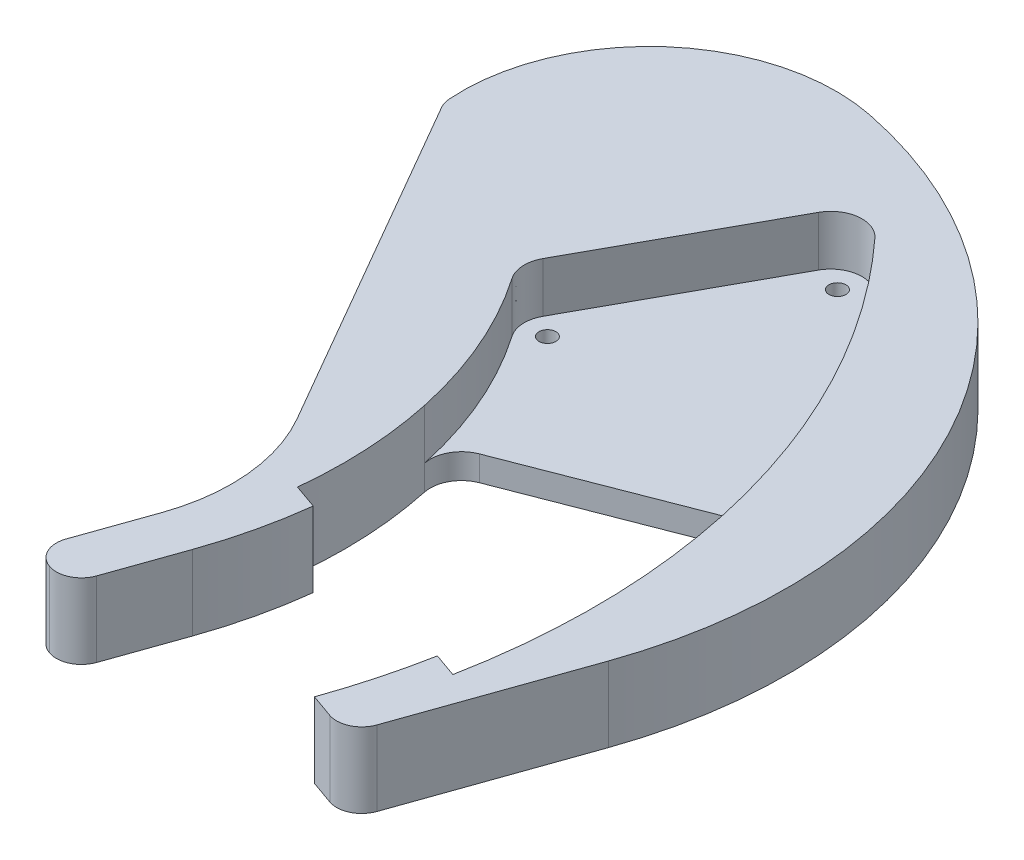
from build123d import *

# Parameters (mm, degrees)
BOSS_EXTRUDE1_DEPTH   = 19.05
CUT_EXTRUDE1_DEPTH    = 219.215212878
BOSS_EXTRUDE2_DEPTH   = 19.05
FILLET1_R             = 6.35
CUT_EXTRUDE2_DEPTH    = 12.7
F_8_CLEARANCE_HOLE1_D = 4.3053


with BuildPart() as part:
    # Sketch1 → Boss-Extrude1 (new body)
    with BuildSketch(Plane(origin=(0, 0, 0), x_dir=(1, 0, 0), z_dir=(0, 1, 0))):
        with BuildLine():
            Line((-47.453228006, 53.404284402), (-98.253228006, 141.392465427))
            ThreePointArc((-98.253228006, 141.392465427), (-82.921975522, 181.453316928), (-41.566473575, 192.839342769))
            ThreePointArc((-41.566473575, 192.839342769), (36.836225704, 136.004392842), (45.380299153, 39.546144899))
            Line((45.380299153, 39.546144899), (27.944541838, -9.861512816))
            Line((27.944541838, -9.861512816), (0, 0))
            Line((0, 0), (-43.950457827, 15.509934128))
            ThreePointArc((-43.950457827, 15.509934128), (-41.550098289, 34.840876427), (-47.453228006, 53.404284402))
        make_face()
    extrude(amount=BOSS_EXTRUDE1_DEPTH)

    # Sketch5 → Cut-Extrude1 (cut, through all)
    with BuildSketch(Plane(origin=(0, 19.05, 0), x_dir=(1, 0, 0), z_dir=(0, 1, 0))):
        with BuildLine():
            Line((-29.23664893, 81.427581144), (15.574383155, 98.792652007))
            ThreePointArc((15.574383155, 98.792652007), (22.053436092, 98.460407789), (26.120098061, 93.405630482))
            ThreePointArc((26.120098061, 93.405630482), (31.67419382, 55.261505814), (28.616328902, 16.836622098))
            Line((28.616328902, 16.836622098), (22.559524164, 18.974043348))
            ThreePointArc((22.559524164, 18.974043348), (19.726825076, 6.545871538), (15.949337201, -5.628454892))
            Line((15.949337201, -5.628454892), (-31.95525319, 11.276876204))
            ThreePointArc((-31.95525319, 11.276876204), (-28.372538305, 23.563648828), (-26.173781301, 36.171824553))
            Line((-26.173781301, 36.171824553), (-32.322028113, 38.341515332))
            ThreePointArc((-32.322028113, 38.341515332), (-31.887912186, 55.427050363), (-34.131380562, 72.370214577))
            ThreePointArc((-34.131380562, 72.370214577), (-33.353370645, 77.801041885), (-29.23664893, 81.427581144))
        make_face()
    extrude(amount=-CUT_EXTRUDE1_DEPTH, mode=Mode.SUBTRACT)

    # Sketch7 → Boss-Extrude2 (add)
    with BuildSketch(Plane(origin=(0, 0, 0), x_dir=(1, 0, 0), z_dir=(0, 1, 0))):
        Polygon((-43.950457827, 15.509934128), (-52.403123375, -8.442361068), (-40.408086707, -12.675359716), (-31.95525319, 11.276876204), align=None)
    extrude(amount=BOSS_EXTRUDE2_DEPTH)

    # Fillet1
    fillet1_edges = [part.edges().sort_by_distance(p)[0] for p in [
        (-98.253228006, 9.525, -141.392465427),
        (27.944541838, 9.525, 9.861512816),
        (-52.403123375, 9.525, 8.442361068),
        (-40.408086707, 9.525, 12.675359716),
    ]]
    fillet(fillet1_edges, radius=FILLET1_R)

    # Sketch6 → Cut-Extrude2 (cut)
    with BuildSketch(Plane(origin=(0, 19.05, 0), x_dir=(1, 0, 0), z_dir=(0, 1, 0))):
        with BuildLine():
            Line((-34.136031583, 72.371811773), (26.116293886, 93.401758977))
            add(Edge.make_bspline(
                [(26.116293886, 93.401758977), (24.324889601, 100.23803776), (22.130168151, 106.901258397), (16.96212823, 119.893613822), (13.988046064, 126.222420918), (9.776956475, 133.921680991), (8.910007749, 135.450921337), (7.126151123, 138.487965199), (6.207974968, 139.997768114), (3.386426272, 144.480432789), (1.42392697, 147.394611788), (-4.701484626, 155.920269738), (-9.100754748, 161.316287945), (-13.809441186, 166.430246232)],
                knots=[0, 0, 0, 0, 0.25, 0.25, 0.5, 0.5, 0.5625, 0.5625, 0.625, 0.625, 0.75, 0.75, 1, 1, 1, 1], degree=3))
            add(Edge.make_bspline(
                [(-26.604572492, 164.8773905), (-26.150591479, 165.703254328), (-25.515446259, 166.400295605), (-24.879031904, 167.098729697), (-24.095373437, 167.628794259), (-23.313760397, 168.1574753), (-22.428907317, 168.488425961), (-21.547481327, 168.818094831), (-20.612298709, 168.932538075), (-19.674896196, 169.047252981), (-18.735576663, 168.938540794), (-17.797334242, 168.829953267), (-16.909699728, 168.503685222), (-16.026331795, 168.178985445), (-15.242553256, 167.655985099), (-14.452846951, 167.129029268), (-13.809441186, 166.430246232)],
                knots=[0, 0, 0, 0.125, 0.125, 0.25, 0.25, 0.375, 0.375, 0.5, 0.5, 0.625, 0.625, 0.75, 0.75, 0.875, 0.875, 1, 1, 1], degree=2))
            Line((-26.604572492, 164.8773905), (-51.39264493, 119.783935416))
            add(Edge.make_bspline(
                [(-50.971516495, 111.453693883), (-51.597295758, 112.361285599), (-51.952278538, 113.405618938), (-52.307499269, 114.450652309), (-52.364051333, 115.554155451), (-52.420577964, 116.657162304), (-52.173441916, 117.734834771), (-51.926064332, 118.813560494), (-51.39264493, 119.783935416)],
                knots=[0, 0, 0, 0.25, 0.25, 0.5, 0.5, 0.75, 0.75, 1, 1, 1], degree=2))
            add(Edge.make_bspline(
                [(-50.971516495, 111.453693883), (-48.958817602, 108.534599247), (-47.092599274, 105.523689489), (-43.653878745, 99.317766492), (-42.08164257, 96.122586505), (-39.950407344, 91.187456603), (-39.27814351, 89.518531936), (-38.021441634, 86.160956199), (-37.435479748, 84.468826365), (-36.34793939, 81.058006993), (-35.846327383, 79.339328012), (-34.927561091, 75.875386956), (-34.510190541, 74.129079907), (-34.136031583, 72.371811773)],
                knots=[0, 0, 0, 0, 0.25, 0.25, 0.5, 0.5, 0.625, 0.625, 0.75, 0.75, 0.875, 0.875, 1, 1, 1, 1], degree=3))
        make_face()
    extrude(amount=-CUT_EXTRUDE2_DEPTH, mode=Mode.SUBTRACT)

    # #8 Clearance Hole1 (through all)
    with Locations(Plane(origin=(0, 0, 0), x_dir=(-1, 0, 0), z_dir=(0, -1, 0))):
        with Locations((46.39038303, 115.861048868), (19.884364695, 162.99531268)):
            Hole(F_8_CLEARANCE_HOLE1_D / 2)


solid = part.part
